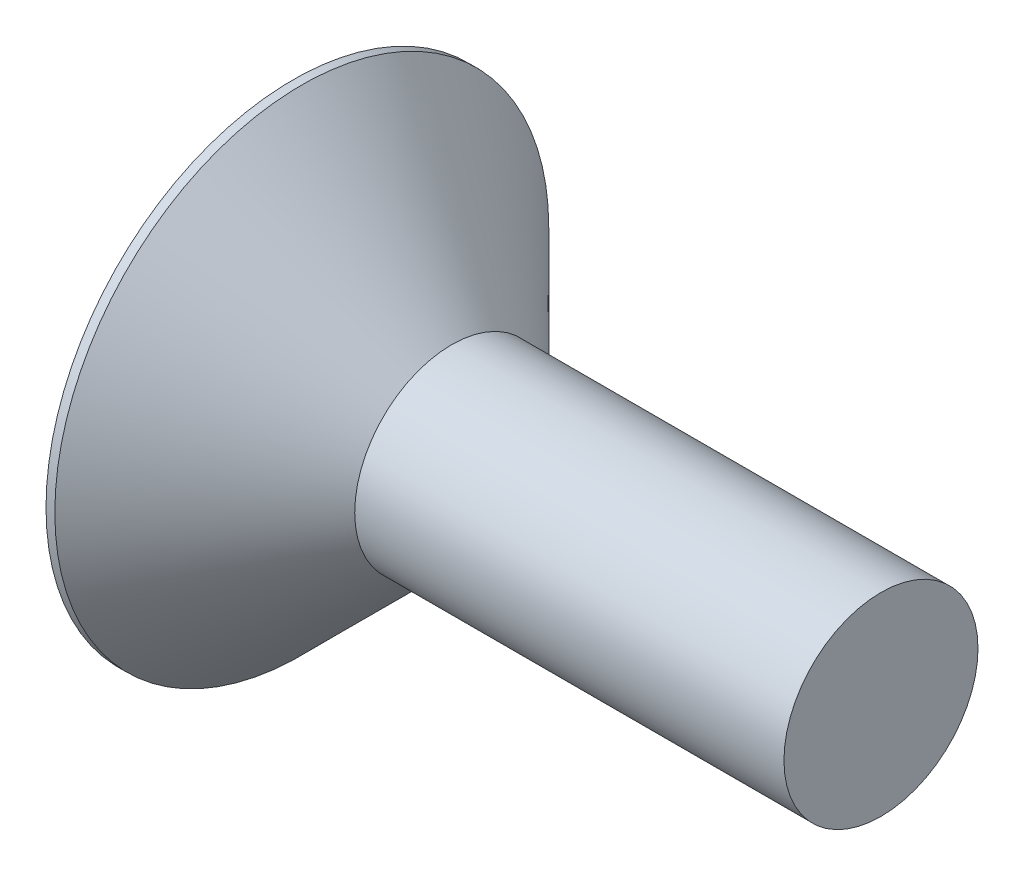
from build123d import *

# Parameters (mm, degrees)
RECPAT_COUNT = 2
RECPAT_ANGLE = 90


with BuildPart() as part:
    # BodySke → Base-Revolve (revolve)
    with BuildSketch(Plane.XY, mode=Mode.PRIVATE) as base_revolve_sk:
        Polygon((0, 0), (0, 4.2), (0.15, 4.2), (2.7, 1.65), (10, 1.65), (10, 0), align=None)
    revolve(base_revolve_sk.sketch.rotate(Axis((-6.35, 0, 0), (1, 0, 0)), 90), axis=Axis((-6.35, 0, 0), (1, 0, 0)))

    # Sketch3 → Recess section 0
    with BuildSketch(Plane.ZY):
        with BuildLine():
            Line((-0.515, 2.2), (0.515, 2.2))
            Line((0.515, 2.2), (0.515, -2.2))
            Line((0.515, -2.2), (-0.515, -2.2))
            Line((-0.515, -2.2), (-0.515, 2.2))
        make_face()
    # Sketch4 → Recess section 1
    with BuildSketch(Plane.ZY.offset(-2.51)):
        with BuildLine():
            Line((-0.515, 0.948560373), (0.515, 0.948560373))
            Line((0.515, 0.948560373), (0.515, -0.948560373))
            Line((0.515, -0.948560373), (-0.515, -0.948560373))
            Line((-0.515, -0.948560373), (-0.515, 0.948560373))
        make_face()
    recess = loft(mode=Mode.SUBTRACT)

    # RecPat: Recess ×2 about axis
    recpat_axis = Axis((0, 0, 0), (1, 0, 0))
    for i in range(1, RECPAT_COUNT):
        add(recess.rotate(recpat_axis, i * RECPAT_ANGLE / (RECPAT_COUNT - 1)), mode=Mode.SUBTRACT)

    # RecCorSke → RecessCore (revolve, cut)
    with BuildSketch(Plane.XY, mode=Mode.PRIVATE) as recesscore_sk:
        Polygon((0, 0), (0, 1.026516298), (2.51, 0.851), (2.786506661, 0), align=None)
    revolve(recesscore_sk.sketch.rotate(Axis((-3.175, 0, 0), (1, 0, 0)), 90), axis=Axis((-3.175, 0, 0), (1, 0, 0)), mode=Mode.SUBTRACT)


solid = part.part
